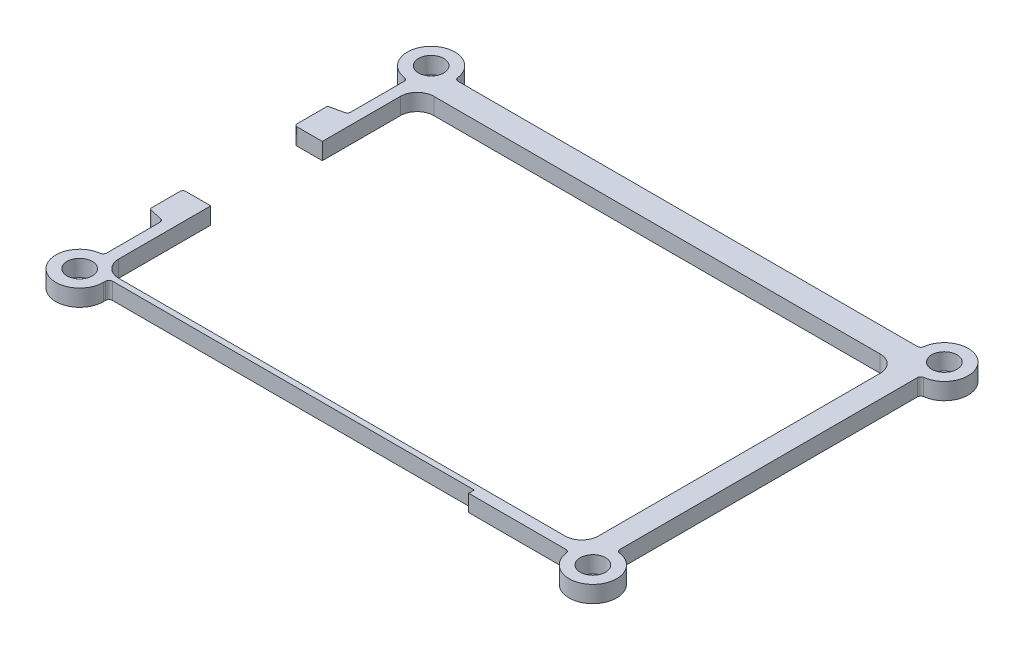
from build123d import *

# Parameters (mm, degrees)
SKETCH1_R           = 2.265
BOSS_EXTRUDE1_DEPTH = 3
SKETCH2_W           = 6.5
SKETCH2_H           = 20
CUT_EXTRUDE1_DEPTH  = 3
BOSS_EXTRUDE2_DEPTH = 3
CUT_EXTRUDE5_DEPTH  = 17
SKETCH9_W           = 65.47
SKETCH9_H           = 1
CUT_EXTRUDE6_DEPTH  = 17
FILLET2_R           = 0.6
FILLET3_R           = 0.1


with BuildPart() as part:
    # Sketch1 → Boss-Extrude1 (new body)
    with BuildSketch(Plane(origin=(0, 0, 0), x_dir=(1, 0, 0), z_dir=(0, 1, 0))):
        with BuildLine():
            Line((4.265, 0), (87.735, 0))
            ThreePointArc((87.735, 0), (95.015810422, 3.015810422), (92, -4.265))
            Line((92, -4.265), (92, -58.735))
            ThreePointArc((92, -58.735), (95.015810422, -66.015810422), (87.735, -63))
            Line((87.735, -63), (4.265, -63))
            ThreePointArc((4.265, -63), (-3.015810422, -66.015810422), (0, -58.735))
            Line((0, -58.735), (0, -4.265))
            ThreePointArc((0, -4.265), (-3.015810422, 3.015810422), (4.265, 0))
        make_face()
        with Locations(Location((0, 0, 0), (0, 0, 270))):
            Circle(SKETCH1_R, mode=Mode.SUBTRACT)
        with Locations(Location((92, 0, 0), (0, 0, 270))):
            Circle(SKETCH1_R, mode=Mode.SUBTRACT)
        with Locations(Location((92, -63, 0), (0, 0, 270))):
            Circle(SKETCH1_R, mode=Mode.SUBTRACT)
        with Locations(Location((0, -63, 0), (0, 0, 270))):
            Circle(SKETCH1_R, mode=Mode.SUBTRACT)
    extrude(amount=BOSS_EXTRUDE1_DEPTH)

    # Sketch2 → Cut-Extrude1 (cut)
    with BuildSketch(Plane(origin=(0, 3, 0), x_dir=(1, 0, 0), z_dir=(0, 1, 0))):
        with Locations((3.25, -31.5)):
            Rectangle(SKETCH2_W, SKETCH2_H)
    extrude(amount=-CUT_EXTRUDE1_DEPTH, mode=Mode.SUBTRACT)

    # Sketch3 → Boss-Extrude2 (add)
    with BuildSketch(Plane(origin=(0, 3, 0), x_dir=(1, 0, 0), z_dir=(0, 1, 0))):
        with BuildLine():
            Line((0, -14.9), (-2.7, -15.5))
            ThreePointArc((-2.7, -15.5), (-2.912132034, -15.587867966), (-3, -15.8))
            Line((-3, -15.8), (-3, -21))
            ThreePointArc((-3, -21), (-2.853553391, -21.353553391), (-2.5, -21.5))
            Line((-2.5, -21.5), (0, -21.5))
            Line((0, -21.5), (0, -14.9))
        make_face()
        with BuildLine():
            Line((0, -41.5), (0, -48.1))
            Line((0, -48.1), (-2.7, -47.5))
            ThreePointArc((-2.7, -47.5), (-2.912132034, -47.412132034), (-3, -47.2))
            Line((-3, -47.2), (-3, -42))
            ThreePointArc((-3, -42), (-2.853553391, -41.646446609), (-2.5, -41.5))
            Line((-2.5, -41.5), (0, -41.5))
        make_face()
    extrude(amount=-BOSS_EXTRUDE2_DEPTH)

    # Sketch8 → Cut-Extrude5 (cut)
    with BuildSketch(Plane(origin=(0, 3, 0), x_dir=(1, 0, 0), z_dir=(0, 1, 0))):
        with BuildLine():
            Line((5, -4.5), (85, -4.5))
            ThreePointArc((85, -4.5), (87.121320344, -5.378679656), (88, -7.5))
            Line((88, -7.5), (88, -58))
            ThreePointArc((88, -58), (87.121320344, -60.121320344), (85, -61))
            Line((85, -61), (5, -61))
            ThreePointArc((5, -61), (2.878679656, -60.121320344), (2, -58))
            Line((2, -58), (2, -7.5))
            ThreePointArc((2, -7.5), (2.878679656, -5.378679656), (5, -4.5))
        make_face()
    extrude(amount=-CUT_EXTRUDE5_DEPTH, mode=Mode.SUBTRACT)

    # Sketch9 → Cut-Extrude6 (cut)
    with BuildSketch(Plane(origin=(0, 3, 0), x_dir=(1, 0, 0), z_dir=(0, 1, 0))):
        with Locations((37, -62.5)):
            Rectangle(SKETCH9_W, SKETCH9_H)
    extrude(amount=-CUT_EXTRUDE6_DEPTH, mode=Mode.SUBTRACT)

    # Fillet2
    fillet2_edges = [part.edges().sort_by_distance(p)[0] for p in [
        (92, 1.5, 4.265),
        (92, 1.5, 58.735),
        (4.265, 1.5, 62),
        (87.735, 1.5, 63),
        (0, 1.5, 58.735),
        (0, 1.5, 4.265),
        (4.265, 1.5, 0),
        (87.735, 1.5, 0),
        (0, 1.5, 14.9),
        (0, 1.5, 48.1),
    ]]
    fillet(fillet2_edges, radius=FILLET2_R)

    # Fillet3
    fillet3_edges = [part.edges().sort_by_distance(p)[0] for p in [
        (69.735, 1.5, 62),
    ]]
    fillet(fillet3_edges, radius=FILLET3_R)


solid = part.part
